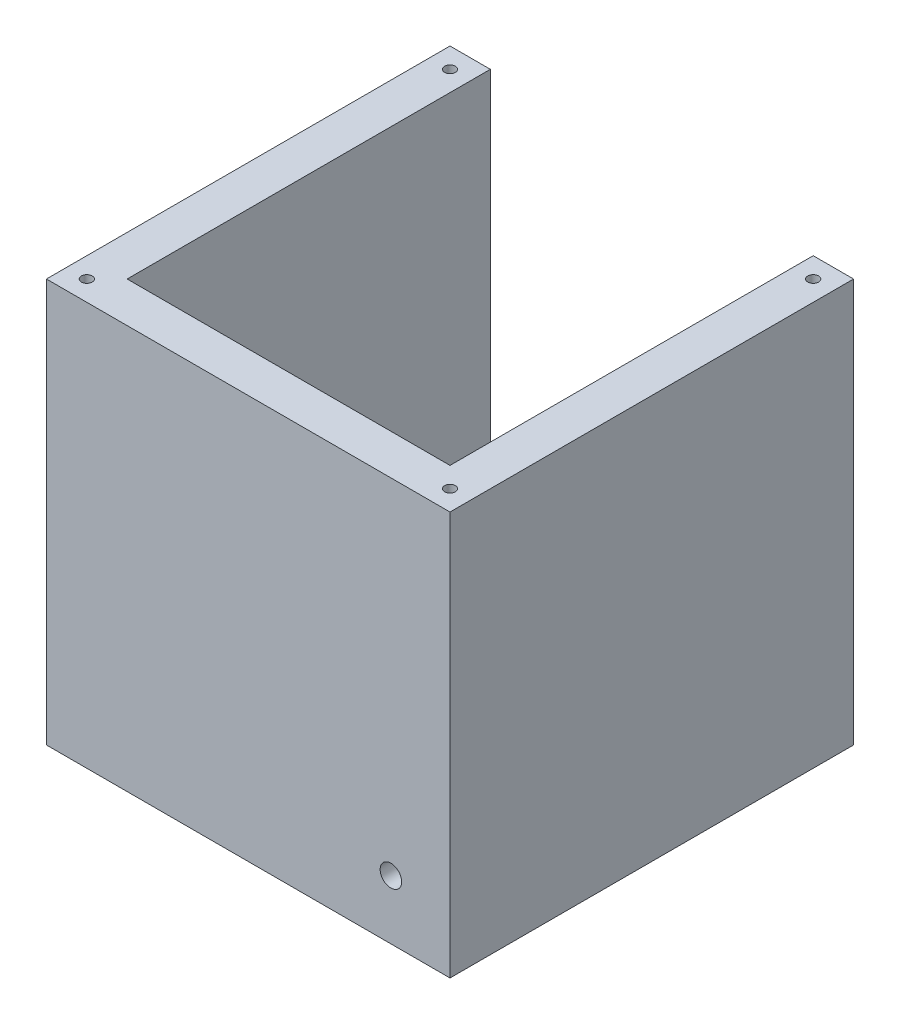
from build123d import *

# Parameters (mm, degrees)
CROQUIS1_W              = 150
CROQUIS1_H              = 150
SALIENTE_EXTRUIR1_DEPTH = 150
CROQUIS2_W              = 120
CROQUIS2_H              = 15
CROQUIS2_H_2            = 120
CORTAR_EXTRUIR1_DEPTH   = 135
CROQUIS3_R              = 2
CORTAR_EXTRUIR2_DEPTH   = 10
CROQUIS4_R              = 2
CORTAR_EXTRUIR3_DEPTH   = 10
CROQUIS5_R              = 4
CORTAR_EXTRUIR4_DEPTH   = 15


with BuildPart() as part:
    # Croquis1 → Saliente-Extruir1 (new body)
    with BuildSketch(Plane.XY):
        Rectangle(CROQUIS1_W, CROQUIS1_H)
    extrude(amount=SALIENTE_EXTRUIR1_DEPTH)

    # Croquis2 → Cortar-Extruir1 (cut)
    with BuildSketch(Plane(origin=(0, 0, 0), x_dir=(-1, 0, 0), z_dir=(0, 0, -1))):
        with Locations((0, 67.5)):
            Rectangle(CROQUIS2_W, CROQUIS2_H)
        Rectangle(CROQUIS2_W, CROQUIS2_H_2)
    extrude(amount=-CORTAR_EXTRUIR1_DEPTH, mode=Mode.SUBTRACT)

    # Croquis3 → Cortar-Extruir2 (cut)
    with BuildSketch(Plane(origin=(0, 75, 0), x_dir=(1, 0, 0), z_dir=(0, 1, 0))):
        with Locations(Location((-67.5, -142.5, 0), (0, 0, 270))):
            Circle(CROQUIS3_R)
        with Locations(Location((67.5, -142.5, 0), (0, 0, 270))):
            Circle(CROQUIS3_R)
        with Locations(Location((67.5, -7.5, 0), (0, 0, 270))):
            Circle(CROQUIS3_R)
        with Locations(Location((-67.5, -7.5, 0), (0, 0, 270))):
            Circle(CROQUIS3_R)
    extrude(amount=-CORTAR_EXTRUIR2_DEPTH, mode=Mode.SUBTRACT)

    # Croquis4 → Cortar-Extruir3 (cut)
    with BuildSketch(Plane(origin=(0, 0, 0), x_dir=(-1, 0, 0), z_dir=(0, 0, -1))):
        with Locations((-67.5, -67.5)):
            Circle(CROQUIS4_R)
        with Locations((67.5, -67.5)):
            Circle(CROQUIS4_R)
        with Locations((67.5, 67.5)):
            Circle(CROQUIS4_R)
        with Locations((-67.5, 67.5)):
            Circle(CROQUIS4_R)
    extrude(amount=-CORTAR_EXTRUIR3_DEPTH, mode=Mode.SUBTRACT)

    # Croquis5 → Cortar-Extruir4 (cut)
    with BuildSketch(Plane.XY.offset(150)):
        with Locations((53.033008589, -53.033008589)):
            Circle(CROQUIS5_R)
    extrude(amount=-CORTAR_EXTRUIR4_DEPTH, mode=Mode.SUBTRACT)


solid = part.part
